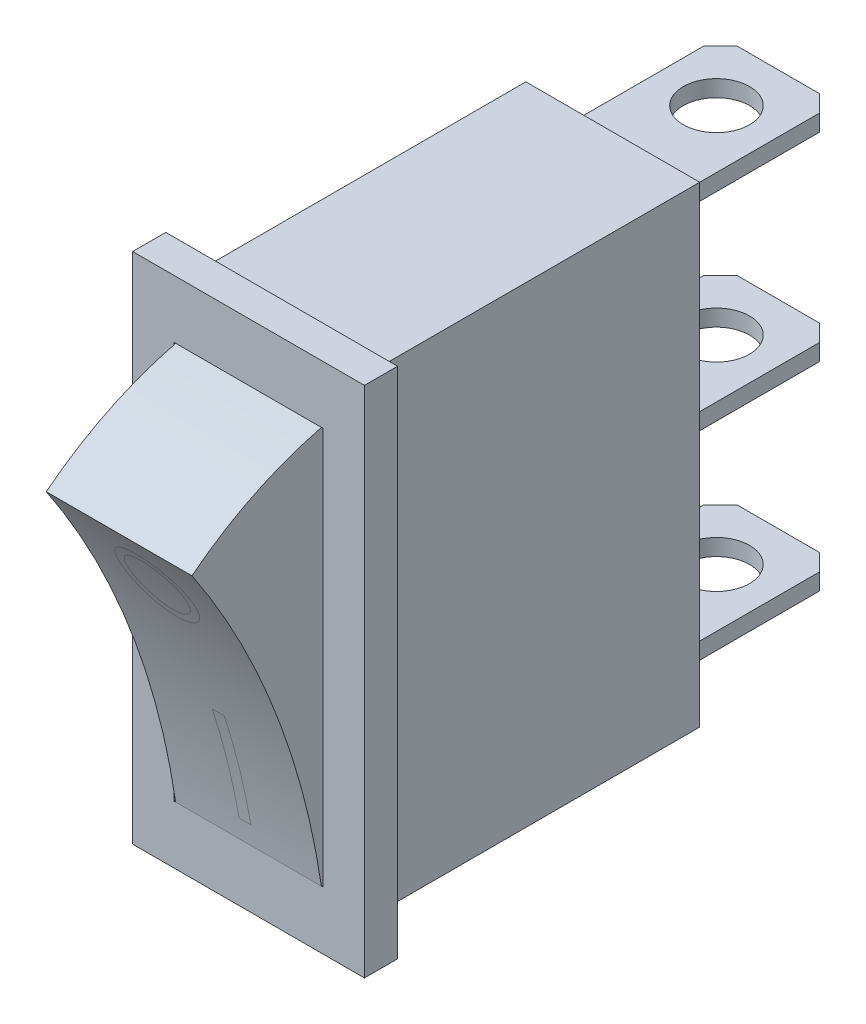
from build123d import *

# Parameters (mm, degrees)
SKETCH1_W           = 14
SKETCH1_H           = 31
SKETCH1_W_2         = 9
SKETCH1_H_2         = 24
BOSS_EXTRUDE1_DEPTH = 2
SKETCH2_W           = 10.5
SKETCH2_H           = 28.5
SKETCH2_W_2         = 9
SKETCH2_H_2         = 24
BOSS_EXTRUDE2_DEPTH = 20
SKETCH3_W           = 10.5
SKETCH3_H           = 28.5
BOSS_EXTRUDE3_DEPTH = 2
SKETCH4_W           = 7
SKETCH4_H           = 1
BOSS_EXTRUDE4_DEPTH = 10
CHAMFER1_SIZE       = 1
LPATTERN1_COUNT     = 2
LPATTERN1_PITCH     = 12
LPATTERN1_2_COUNT   = 2
LPATTERN1_2_PITCH   = 12
SKETCH6_R           = 2
CUT_EXTRUDE1_DEPTH  = 42.629316593
BOSS_EXTRUDE5_DEPTH = 4.4


with BuildPart() as part:
    # Sketch1 → Boss-Extrude1 (new body)
    with BuildSketch(Plane.XY):
        Rectangle(SKETCH1_W, SKETCH1_H)
        Rectangle(SKETCH1_W_2, SKETCH1_H_2, mode=Mode.SUBTRACT)
    extrude(amount=BOSS_EXTRUDE1_DEPTH)

    # Sketch2 → Boss-Extrude2 (add)
    with BuildSketch(Plane.XY):
        Rectangle(SKETCH2_W, SKETCH2_H)
        Rectangle(SKETCH2_W_2, SKETCH2_H_2, mode=Mode.SUBTRACT)
    extrude(amount=-BOSS_EXTRUDE2_DEPTH)

    # Sketch3 → Boss-Extrude3 (add)
    with BuildSketch(Plane(origin=(0, 0, -20), x_dir=(-1, 0, 0), z_dir=(0, 0, -1))):
        Rectangle(SKETCH3_W, SKETCH3_H)
    extrude(amount=-BOSS_EXTRUDE3_DEPTH)


with BuildPart() as body_2:
    # Sketch4 → Boss-Extrude4 (new body)
    with BuildSketch(Plane(origin=(0, 0, -20), x_dir=(-1, 0, 0), z_dir=(0, 0, -1))):
        Rectangle(SKETCH4_W, SKETCH4_H)
    extrude(amount=BOSS_EXTRUDE4_DEPTH)

    # Chamfer1
    chamfer1_edges = [body_2.edges().sort_by_distance(p)[0] for p in [
        (3.5, 0, -30),
        (-3.5, 0, -30),
    ]]
    chamfer(chamfer1_edges, length=CHAMFER1_SIZE)


with BuildPart() as lpattern1_1:
    # LPattern1: pattern copy
    add(body_2.part.moved(Location(Vector(0, -1, 0) * (1 * LPATTERN1_PITCH))))


with BuildPart() as lpattern1_2_1:
    # LPattern1 2: pattern copy
    add(body_2.part.moved(Location(Vector(0, 1, 0) * (1 * LPATTERN1_2_PITCH))))


with BuildPart() as cut_extrude1_tool:
    # Sketch6 → Cut-Extrude1 (new, through all)
    with BuildSketch(Plane.XZ.offset(12.5)):
        with Locations(Location((0, -26.261190852, 0), (0, 0, 270))):
            Circle(SKETCH6_R)
    extrude(amount=-CUT_EXTRUDE1_DEPTH)


with BuildPart() as body_2_1:
    add(body_2.part)

    # Cut-Extrude1: cut by cut_extrude1_tool
    add(cut_extrude1_tool.part, mode=Mode.SUBTRACT)


with BuildPart() as lpattern1_1_1:
    add(lpattern1_1.part)

    # Cut-Extrude1: cut by cut_extrude1_tool
    add(cut_extrude1_tool.part, mode=Mode.SUBTRACT)


with BuildPart() as lpattern1_2_1_1:
    add(lpattern1_2_1.part)

    # Cut-Extrude1: cut by cut_extrude1_tool
    add(cut_extrude1_tool.part, mode=Mode.SUBTRACT)


with BuildPart() as body_5:
    # Sketch7 → Boss-Extrude5 (new, symmetric)
    with BuildSketch(Plane(origin=(0, 0, 0), x_dir=(0, 0, -1), z_dir=(1, 0, 0))):
        with BuildLine():
            Line((-2, -12), (3.035249644, -12))
            Line((3.035249644, -12), (3.035249644, 12))
            Line((3.035249644, 12), (-2, 12))
            ThreePointArc((-2, 12), (-6.114287528, 10.489568636), (-9.818258603, 8.14662966))
            ThreePointArc((-9.818258603, 8.14662966), (-4.785245382, -1.49054199), (-2, -12))
        make_face()
    extrude(amount=BOSS_EXTRUDE5_DEPTH, both=True)


solid = Compound([part.part, body_2_1.part, lpattern1_1_1.part, lpattern1_2_1_1.part, body_5.part])
